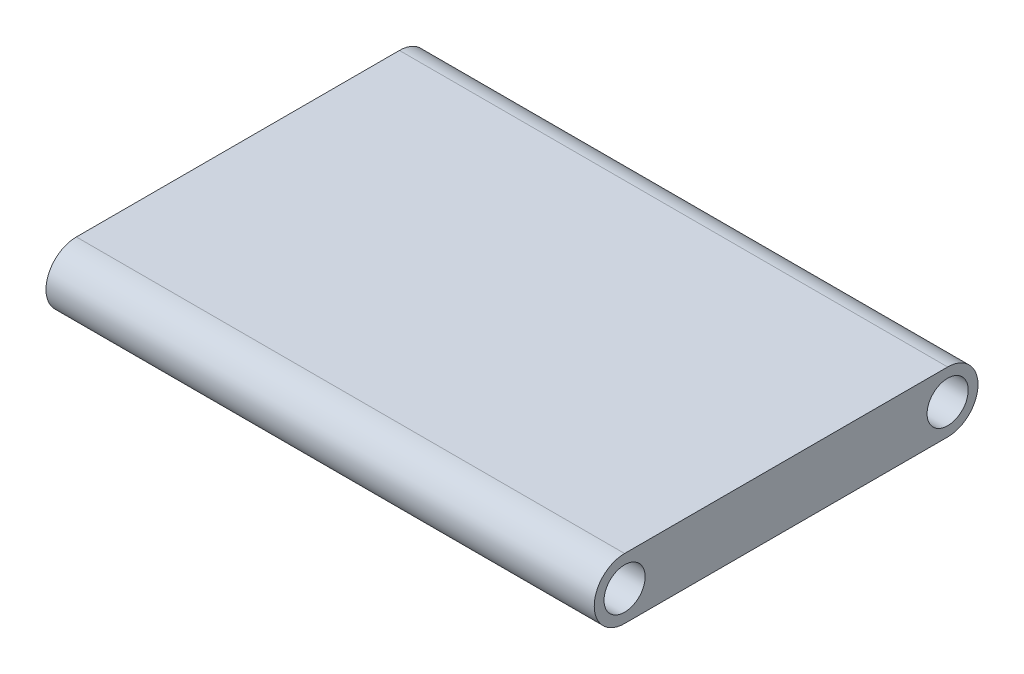
from build123d import *

# Parameters (mm, degrees)
SKETCH3_W               = 280
SKETCH3_H               = 31
BOSS_EXTRUDE1_DEPTH     = 196
CUT_EXTRUDE1_DEPTH      = 349.449961347
CUT_EXTRUDE1_DEPTH_BACK = 349.449961347
SKETCH6_R               = 10.5
CUT_EXTRUDE2_DEPTH      = 37


with BuildPart() as part:
    # Sketch3 → Boss-Extrude1 (new body)
    with BuildSketch(Plane.XY):
        with Locations((-140, 52.333439857)):
            Rectangle(SKETCH3_W, SKETCH3_H)
    extrude(amount=BOSS_EXTRUDE1_DEPTH)

    # Sketch4 → Cut-Extrude1 (cut, two sides: drawn at the far end of the back side and taken through both)
    with BuildSketch(Plane(origin=(0, 0, 0), x_dir=(0, 0, -1), z_dir=(1, 0, 0)).offset(-CUT_EXTRUDE1_DEPTH_BACK)):
        with BuildLine():
            Line((-180.5, 67.833439857), (-180.5, 68.833439857))
            Line((-180.5, 68.833439857), (-197, 68.833439857))
            Line((-197, 68.833439857), (-197, 35.833439857))
            Line((-197, 35.833439857), (-180.5, 35.833439857))
            Line((-180.5, 35.833439857), (-180.5, 36.833439857))
            ThreePointArc((-180.5, 36.833439857), (-196, 52.333439857), (-180.5, 67.833439857))
        make_face()
        with BuildLine():
            Line((-15.5, 67.833439857), (-15.5, 68.833439857))
            Line((-15.5, 68.833439857), (1, 68.833439857))
            Line((1, 68.833439857), (1, 35.833439857))
            Line((1, 35.833439857), (-15.5, 35.833439857))
            Line((-15.5, 35.833439857), (-15.5, 36.833439857))
            ThreePointArc((-15.5, 36.833439857), (0, 52.333439857), (-15.5, 67.833439857))
        make_face()
    extrude(amount=CUT_EXTRUDE1_DEPTH + CUT_EXTRUDE1_DEPTH_BACK, mode=Mode.SUBTRACT)

    # Sketch6 → Cut-Extrude2 (cut)
    with BuildSketch(Plane(origin=(0, 0, 0), x_dir=(0, 0, -1), z_dir=(1, 0, 0))):
        with Locations((-180.5, 52.333439857)):
            Circle(SKETCH6_R)
        with Locations((-15.5, 52.333439857)):
            Circle(SKETCH6_R)
    extrude(amount=-CUT_EXTRUDE2_DEPTH, mode=Mode.SUBTRACT)


solid = part.part
